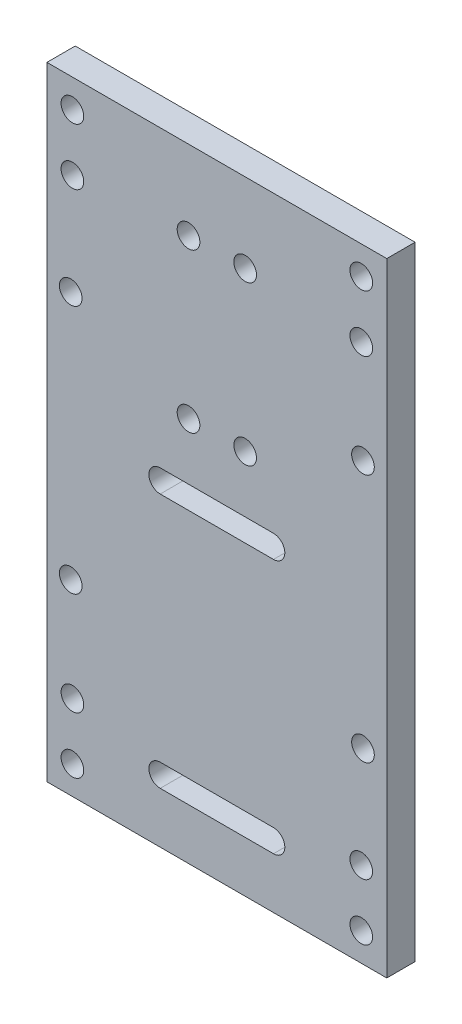
from build123d import *

# Parameters (mm, degrees)
SKETCH1_W           = 76.2
SKETCH1_H           = 139.7
BOSS_EXTRUDE1_DEPTH = 6.35
SKETCH2_R           = 2.54
CUT_EXTRUDE1_DEPTH  = 15.24
SKETCH3_R           = 2.54
CUT_EXTRUDE2_DEPTH  = 15.24
SKETCH4_R           = 2.54
CUT_EXTRUDE3_DEPTH  = 7.62
CUT_EXTRUDE4_DEPTH  = 7.62


with BuildPart() as part:
    # Sketch1 → Boss-Extrude1 (new body)
    with BuildSketch(Plane.XY):
        with Locations((-13.133014553, 21.815443873)):
            Rectangle(SKETCH1_W, SKETCH1_H)
    extrude(amount=BOSS_EXTRUDE1_DEPTH)

    # Sketch2 → Cut-Extrude1 (cut)
    with BuildSketch(Plane(origin=(0, 0, 0), x_dir=(-1, 0, 0), z_dir=(0, 0, -1))):
        with Locations((45.518014553, 85.315443873)):
            Circle(SKETCH2_R)
        with Locations((45.518014553, 72.615443873)):
            Circle(SKETCH2_R)
        with Locations((45.518014553, -28.984556127)):
            Circle(SKETCH2_R)
        with Locations((45.518014553, -41.684556127)):
            Circle(SKETCH2_R)
        with Locations((-19.251985447, -41.684556127)):
            Circle(SKETCH2_R)
        with Locations((-19.251985447, -28.984556127)):
            Circle(SKETCH2_R)
        with Locations((-19.251985447, 85.315443873)):
            Circle(SKETCH2_R)
        with Locations((-19.251985447, 72.615443873)):
            Circle(SKETCH2_R)
    extrude(amount=-CUT_EXTRUDE1_DEPTH, mode=Mode.SUBTRACT)

    # Sketch3 → Cut-Extrude2 (cut)
    with BuildSketch(Plane.XY.offset(6.35)):
        with Locations((-19.483014553, 38.325443873)):
            Circle(SKETCH3_R)
        with Locations((-6.783014553, 38.325443873)):
            Circle(SKETCH3_R)
        with Locations((-19.483014553, 73.885443873)):
            Circle(SKETCH3_R)
        with Locations((-6.783014553, 73.885443873)):
            Circle(SKETCH3_R)
    extrude(amount=-CUT_EXTRUDE2_DEPTH, mode=Mode.SUBTRACT)

    # Sketch4 → Cut-Extrude3 (cut)
    with BuildSketch(Plane.XY.offset(6.35)):
        with Locations((-45.899014553, 49.755443873)):
            Circle(SKETCH4_R)
        with Locations((-45.899014553, -6.124556127)):
            Circle(SKETCH4_R)
        with Locations((19.632985447, -6.124556127)):
            Circle(SKETCH4_R)
        with Locations((19.632985447, 49.755443873)):
            Circle(SKETCH4_R)
    extrude(amount=-CUT_EXTRUDE3_DEPTH, mode=Mode.SUBTRACT)

    # Sketch5 → Cut-Extrude4 (cut)
    with BuildSketch(Plane(origin=(0, 0, 0), x_dir=(-1, 0, 0), z_dir=(0, 0, -1))):
        with BuildLine():
            Line((0.433014553, 25.625443873), (25.833014553, 25.625443873))
            ThreePointArc((25.833014553, 25.625443873), (28.373014553, 23.085443873), (25.833014553, 20.545443873))
            Line((25.833014553, 20.545443873), (0.433014553, 20.545443873))
            ThreePointArc((0.433014553, 20.545443873), (-2.106985447, 23.085443873), (0.433014553, 25.625443873))
        make_face()
        with BuildLine():
            Line((0.433014553, -31.524556127), (25.833014553, -31.524556127))
            ThreePointArc((25.833014553, -31.524556127), (28.373014553, -34.064556127), (25.833014553, -36.604556127))
            Line((25.833014553, -36.604556127), (0.433014553, -36.604556127))
            ThreePointArc((0.433014553, -36.604556127), (-2.106985447, -34.064556127), (0.433014553, -31.524556127))
        make_face()
    extrude(amount=-CUT_EXTRUDE4_DEPTH, mode=Mode.SUBTRACT)


solid = part.part
